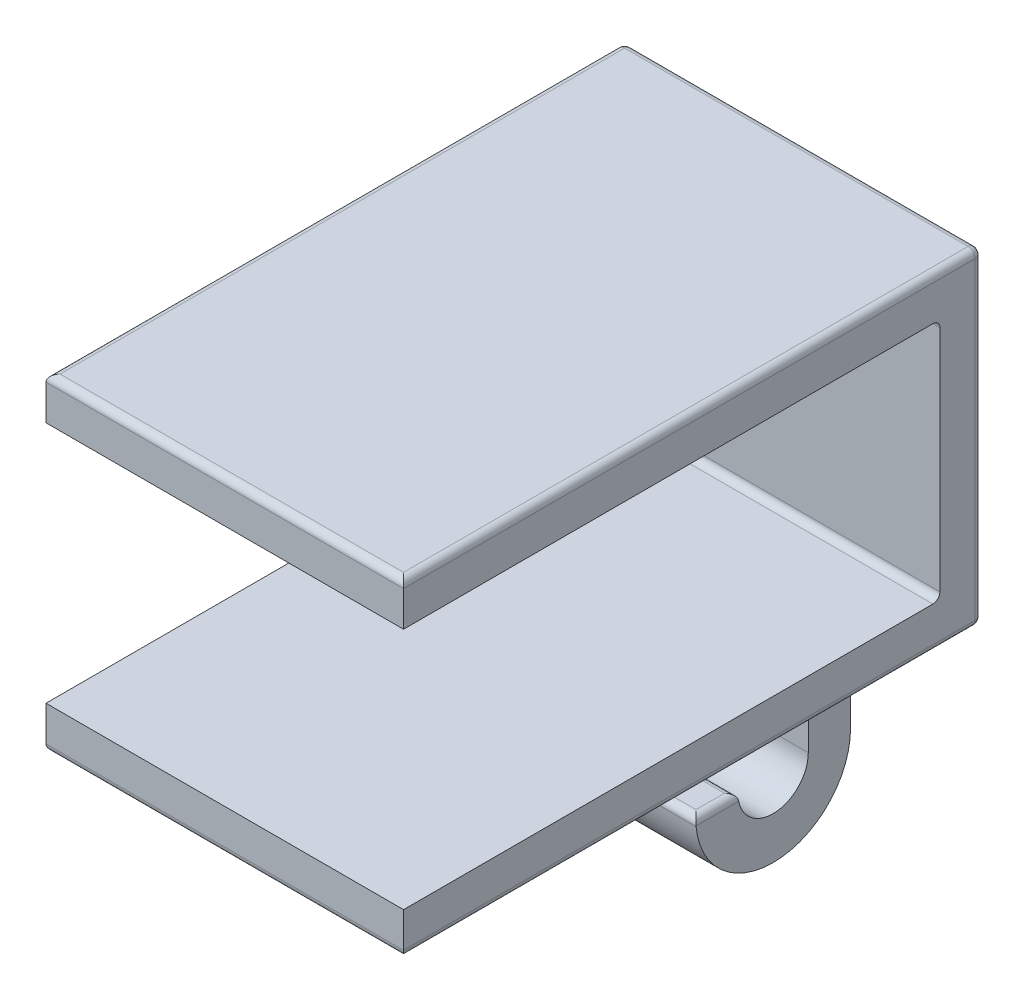
from build123d import *

# Parameters (mm, degrees)
BOSS_EXTRUDE1_DEPTH = 25.4
BOSS_EXTRUDE3_DEPTH = 25.4
CUT_EXTRUDE5_DEPTH  = 6.35
CUT_EXTRUDE6_START  = -6.35
CUT_EXTRUDE6_DEPTH  = 6.35
FILLET1_R           = 2.5
FILLET2_R           = 2.5
FILLET3_R           = 0.5
FILLET4_R           = 0.5
FILLET5_R           = 0.5


with BuildPart() as part:
    # Sketch1 → Boss-Extrude1 (new body)
    with BuildSketch(Plane(origin=(0, 0, 0), x_dir=(0, 0, -1), z_dir=(1, 0, 0))):
        Polygon((0, 0), (38.1, 0), (38.1, -17.25), (0, -17.250000000000004), (3.4e-16, -20.250000000000007), (41.1, -20.250000000000007), (41.099999999999994, 3), (-1.8e-16, 2.999999999999995), align=None)
    extrude(amount=BOSS_EXTRUDE1_DEPTH)

    # Sketch7 → Boss-Extrude3 (add)
    with BuildSketch(Plane.ZY):
        with BuildLine():
            Line((-38.1, -20.250000000000007), (-38.10000000000001, -28.33631785905126))
            ThreePointArc((-38.10000000000001, -28.33631785905126), (-32.6, -33.83631785905126), (-27.100000000000005, -28.336317859051263))
            Line((-27.100000000000005, -28.336317859051263), (-30.100000000000005, -28.33631785905126))
            ThreePointArc((-30.100000000000005, -28.33631785905126), (-32.607239712312804, -30.821806864386282), (-35.1, -28.32179632065465))
            Line((-35.1, -28.32179632065465), (-35.1, -20.250000000000007))
            Line((-35.1, -20.250000000000007), (-38.1, -20.250000000000007))
        make_face()
    extrude(amount=-BOSS_EXTRUDE3_DEPTH)

    # Sketch8 → Cut-Extrude5 (cut)
    with BuildSketch(Plane.ZY):
        with BuildLine():
            Line((-35.1, -20.250000000000007), (-38.1, -20.250000000000007))
            Line((-38.1, -20.250000000000007), (-38.10000000000001, -28.3363178590513))
            ThreePointArc((-38.10000000000001, -28.3363178590513), (-32.59999999999998, -33.83631785905126), (-27.100000000000005, -28.336317859051263))
            Line((-27.100000000000005, -28.336317859051263), (-30.10000000000001, -28.33631785905126))
            ThreePointArc((-30.10000000000001, -28.33631785905126), (-32.6072397123128, -30.82180686438628), (-35.1, -28.321796320654666))
            Line((-35.1, -28.321796320654666), (-35.1, -20.250000000000007))
        make_face()
    extrude(amount=-CUT_EXTRUDE5_DEPTH, mode=Mode.SUBTRACT)

    # Sketch9 → Cut-Extrude6 (cut)
    with BuildSketch(Plane(origin=(25.4, 0, 0), x_dir=(0, 0, -1), z_dir=(1, 0, 0)).offset(CUT_EXTRUDE6_START)):
        with BuildLine():
            Line((35.1, -20.250000000000007), (38.1, -20.250000000000007))
            Line((38.1, -20.250000000000007), (38.10000000000001, -28.33631785905126))
            ThreePointArc((38.10000000000001, -28.33631785905126), (32.6, -33.83631785905126), (27.100000000000005, -28.336317859051263))
            Line((27.100000000000005, -28.336317859051263), (30.10000000000001, -28.33631785905126))
            ThreePointArc((30.10000000000001, -28.33631785905126), (32.607239712312804, -30.82180686438628), (35.1, -28.32179632065465))
            Line((35.1, -28.32179632065465), (35.1, -20.250000000000007))
        make_face()
    extrude(amount=CUT_EXTRUDE6_DEPTH, mode=Mode.SUBTRACT)

    # Fillet1
    fillet1_edges = [part.edges().sort_by_distance(p)[0] for p in [
        (12.7, -20.250000000000007, -35.1),
        (12.7, -20.250000000000007, -38.1),
    ]]
    fillet(fillet1_edges, radius=FILLET1_R)

    # Fillet2
    fillet2_edges = [part.edges().sort_by_distance(p)[0] for p in [
        (6.35, -20.250000000000007, -36.599999999999994),
        (19.049999999999997, -20.250000000000007, -36.599999999999994),
    ]]
    fillet(fillet2_edges, radius=FILLET2_R)

    # Fillet3
    fillet3_edges = [part.edges().sort_by_distance(p)[0] for p in [
        (12.7, 2.999999999999995, 1.8e-16),
        (12.7, 3, -41.099999999999994),
        (12.7, -20.250000000000007, -41.1),
        (12.7, -20.250000000000007, -3.4e-16),
        (25.4, -20.250000000000007, -20.55),
        (25.4, -8.625000000000004, -41.099999999999994),
        (25.4, 2.9999999999999973, -20.549999999999997),
        (0, 2.9999999999999973, -20.549999999999997),
        (0, -8.625000000000004, -41.099999999999994),
        (0, -20.250000000000007, -20.55),
    ]]
    fillet(fillet3_edges, radius=FILLET3_R)

    # Fillet4
    fillet4_edges = [part.edges().sort_by_distance(p)[0] for p in [
        (6.35, -28.336317859051263, -28.60000000000001),
        (12.7, -28.336317859051263, -27.100000000000005),
        (12.7, -28.33631785905126, -30.100000000000005),
        (19.049999999999997, -28.336317859051263, -28.60000000000001),
    ]]
    fillet(fillet4_edges, radius=FILLET4_R)

    # Fillet5
    fillet5_edges = [part.edges().sort_by_distance(p)[0] for p in [
        (12.7, -17.25, -38.1),
        (12.7, 0, -38.1),
    ]]
    fillet(fillet5_edges, radius=FILLET5_R)


solid = part.part
